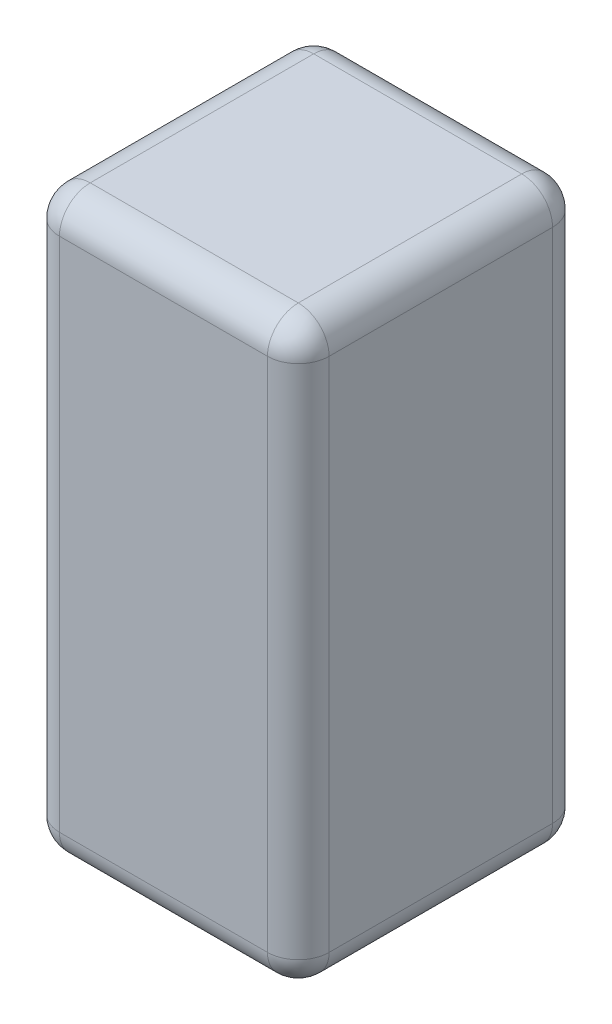
from build123d import *

# Parameters (mm, degrees)
SKETCH2_W           = 35
SKETCH2_H           = 75
BOSS_EXTRUDE1_DEPTH = 37
FILLET1_R           = 4


with BuildPart() as part:
    # Sketch2 → Boss-Extrude1 (new body)
    with BuildSketch(Plane.XY.offset(4)):
        Rectangle(SKETCH2_W, SKETCH2_H)
    extrude(amount=BOSS_EXTRUDE1_DEPTH)

    # Fillet1
    fillet1_edges = [part.edges().sort_by_distance(p)[0] for p in [
        (-17.5, 0, 41),
        (0, -37.5, 41),
        (17.5, 0, 41),
        (0, -37.5, 4),
        (-17.5, 0, 4),
        (0, 37.5, 4),
        (17.5, 0, 4),
        (17.5, -37.5, 22.5),
        (-17.5, -37.5, 22.5),
        (-17.5, 37.5, 22.5),
        (17.5, 37.5, 22.5),
        (0, 37.5, 41),
    ]]
    fillet(fillet1_edges, radius=FILLET1_R)


solid = part.part
